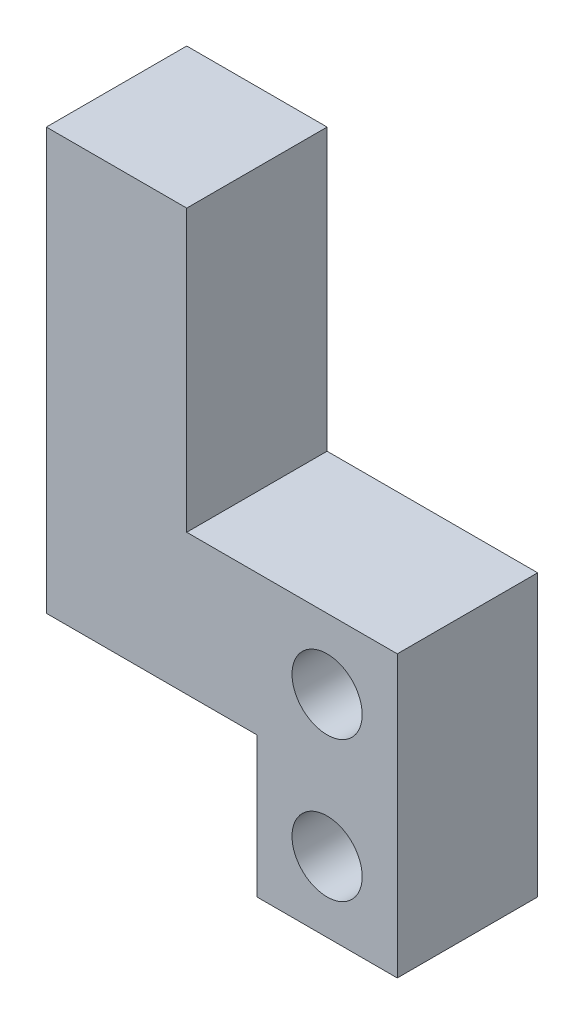
from build123d import *

# Parameters (mm, degrees)
ESQUISSE1_R        = 2.5
BOSS_EXTRU_1_DEPTH = 10


with BuildPart() as part:
    # Esquisse1 → Boss.-Extru.1 (new body)
    with BuildSketch(Plane.XY):
        Polygon((-12.5, -5), (2.5, -5), (2.5, -15), (12.5, -15), (12.5, -5), (12.5, 5), (-2.5, 5), (-2.5, 25), (-12.5, 25), (-12.5, 5), align=None)
        with Locations((7.5, -10)):
            Circle(ESQUISSE1_R, mode=Mode.SUBTRACT)
        with Locations((7.5, 0)):
            Circle(ESQUISSE1_R, mode=Mode.SUBTRACT)
    extrude(amount=BOSS_EXTRU_1_DEPTH)


solid = part.part
